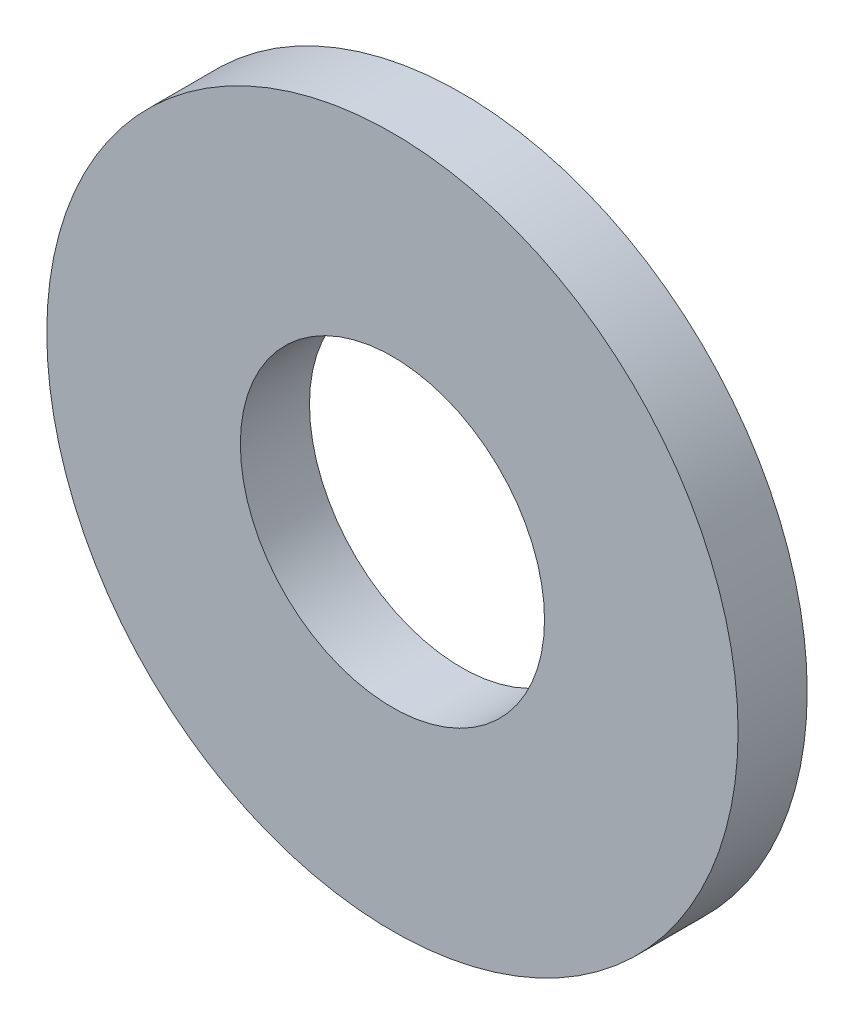
from build123d import *

# Parameters (mm, degrees)
WASHER_PROFILE_R   = 2.5
WASHER_PROFILE_R_2 = 1.1
WASHER_DEPTH       = 0.5


with BuildPart() as part:
    # Washer_profile → Washer (new body)
    with BuildSketch(Plane.XY):
        Circle(WASHER_PROFILE_R)
        Circle(WASHER_PROFILE_R_2, mode=Mode.SUBTRACT)
    extrude(amount=WASHER_DEPTH)


solid = part.part
